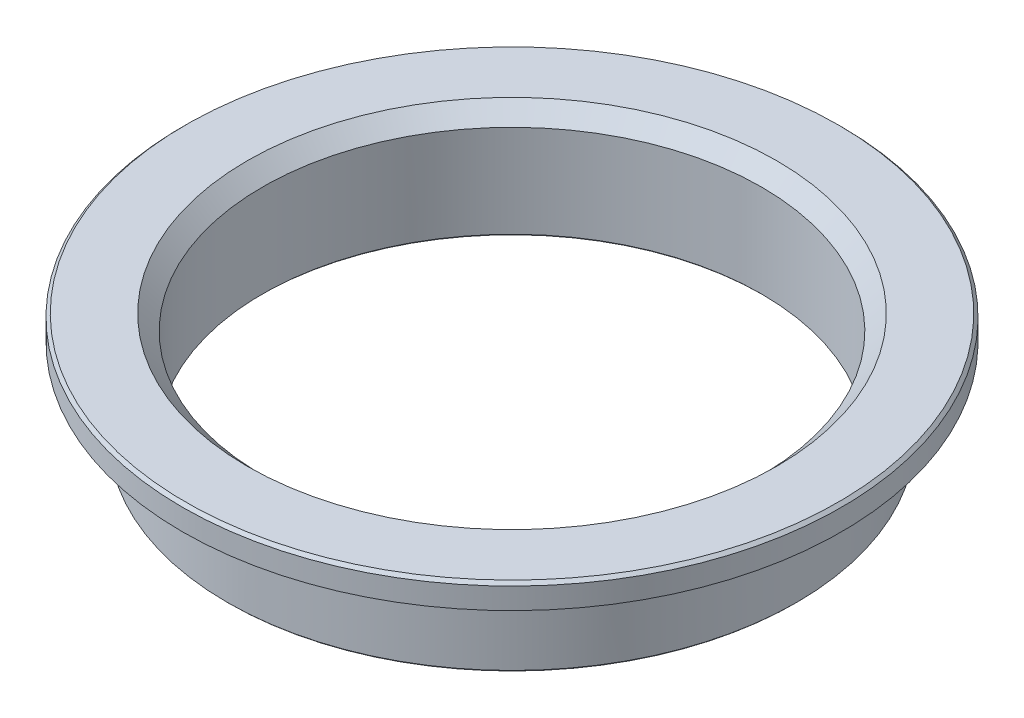
from build123d import *

# Parameters (mm, degrees)
CHAMFER1_SIZE     = 10
CIRPATTERN1_COUNT = 24
CHAMFER2_SIZE     = 1
CHAMFER3_SIZE     = 2


with BuildPart() as part:
    # Sketch1 → Revolve1 (revolve)
    with BuildSketch(Plane.XY):
        Polygon((-187.5, 0), (-164.3, 0), (-164.3, 72), (-217, 72), (-217, 56), (-190, 56), (-190, 38), (-187.5, 38), align=None)
    revolve(axis=Axis((0, 0, 0), (0, 1, 0)))

    # Chamfer1
    chamfer1_edges = [part.edges().sort_by_distance(p)[0] for p in [
        (164.3, 72, 0),
    ]]
    chamfer(chamfer1_edges, length=CHAMFER1_SIZE)

    # Sketch4 → M12x1.75 Tapped Hole1 (revolve, cut)
    with BuildSketch(Plane(origin=(0, 0, 174), x_dir=(0, 0, -1), z_dir=(1, 0, 0))):
        Polygon((0, 0), (0, 41.064389157), (5.1, 38), (5.1, 0), align=None)
    m12x1_75_tapped_hole1 = revolve(axis=Axis((0, -6.35, 174), (0, 1, 0)), mode=Mode.SUBTRACT)

    # CirPattern1: M12x1.75 Tapped Hole1 ×24 about axis
    cirpattern1_axis = Axis((0, 0, 0), (0, -1, 0))
    for i in range(1, CIRPATTERN1_COUNT):
        add(m12x1_75_tapped_hole1.rotate(cirpattern1_axis, i * 360 / CIRPATTERN1_COUNT), mode=Mode.SUBTRACT)

    # Chamfer2
    chamfer2_edges = [part.edges().sort_by_distance(p)[0] for p in [
        (190, 38, 0),
        (187.5, 0, 0),
        (164.3, 0, 0),
    ]]
    chamfer(chamfer2_edges, length=CHAMFER2_SIZE)

    # Chamfer3
    chamfer3_edges = [part.edges().sort_by_distance(p)[0] for p in [
        (217, 72, 0),
    ]]
    chamfer(chamfer3_edges, length=CHAMFER3_SIZE)


solid = part.part
